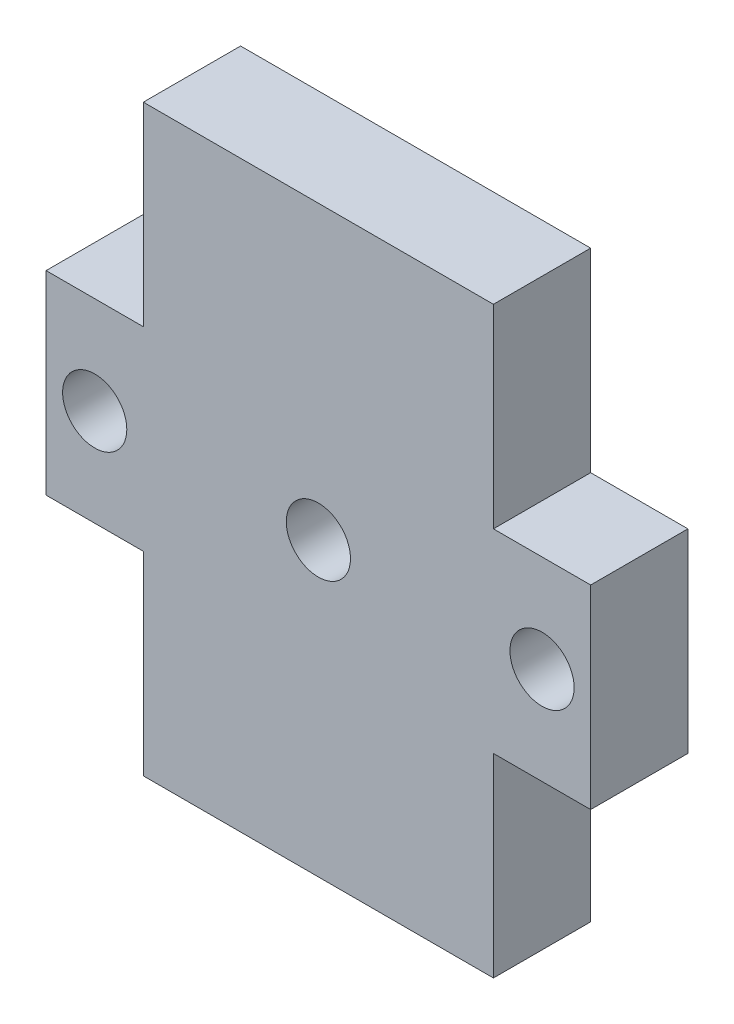
from build123d import *

# Parameters (mm, degrees)
SKETCH1_W           = 35.56
SKETCH1_H           = 38.1
BOSS_EXTRUDE1_DEPTH = 6.35
SKETCH2_W           = 6.35
SKETCH2_H           = 12.7
CUT_EXTRUDE1_DEPTH  = 27.820764344
SKETCH3_R           = 2.0955
CUT_EXTRUDE2_DEPTH  = 27.820764344
SKETCH4_R           = 2.0955
CUT_EXTRUDE3_DEPTH  = 27.820764344


with BuildPart() as part:
    # Sketch1 → Boss-Extrude1 (new body)
    with BuildSketch(Plane.XY):
        Rectangle(SKETCH1_W, SKETCH1_H)
    extrude(amount=BOSS_EXTRUDE1_DEPTH)

    # Sketch2 → Cut-Extrude1 (cut, through all)
    with BuildSketch(Plane.XY.offset(6.35)):
        with Locations((14.605, -12.7)):
            Rectangle(SKETCH2_W, SKETCH2_H)
        with Locations((14.605, 12.7)):
            Rectangle(SKETCH2_W, SKETCH2_H)
        with Locations((-14.605, 12.7)):
            Rectangle(SKETCH2_W, SKETCH2_H)
        with Locations((-14.605, -12.7)):
            Rectangle(SKETCH2_W, SKETCH2_H)
    extrude(amount=-CUT_EXTRUDE1_DEPTH, mode=Mode.SUBTRACT)

    # Sketch3 → Cut-Extrude2 (cut, through all)
    with BuildSketch(Plane.XY.offset(6.35)):
        with Locations((14.605, 0)):
            Circle(SKETCH3_R)
        with Locations((-14.605, 0)):
            Circle(SKETCH3_R)
    extrude(amount=-CUT_EXTRUDE2_DEPTH, mode=Mode.SUBTRACT)

    # Sketch4 → Cut-Extrude3 (cut, through all)
    with BuildSketch(Plane.XY.offset(6.35)):
        Circle(SKETCH4_R)
    extrude(amount=-CUT_EXTRUDE3_DEPTH, mode=Mode.SUBTRACT)


solid = part.part
